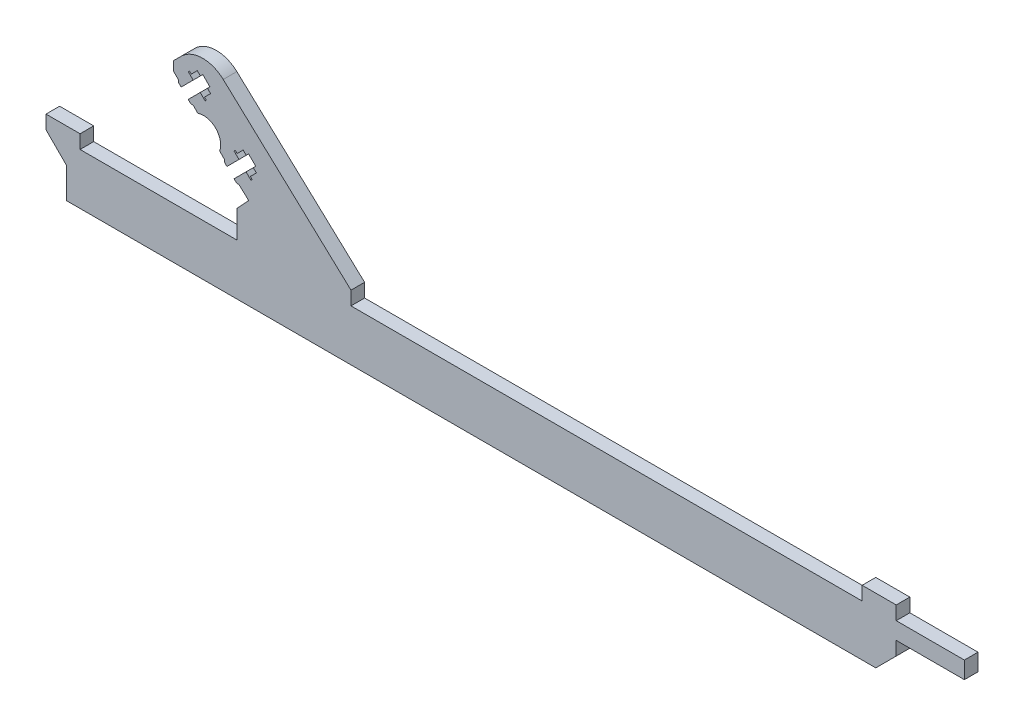
from build123d import *

# Parameters (mm, degrees)
BOSS_EXTRUDE1_DEPTH = 4
CHAMFER1_SIZE       = 6
SKETCH2_R           = 0.357314597
CUT_EXTRUDE1_DEPTH  = 1


with BuildPart() as part:
    # Sketch1 → Boss-Extrude1 (new body)
    with BuildSketch(Plane.XY):
        with BuildLine():
            Line((-193.5, 5), (-193.5, 13.029022597))
            Line((-193.5, 13.029022597), (-190.028351822, 16.768866664))
            Line((-190.028351822, 16.768866664), (-192.886698165, 19.422232071))
            Line((-192.886698165, 19.422232071), (-193.593804946, 19.422232071))
            Line((-193.593804946, 19.422232071), (-194.318589397, 20.147016522))
            Line((-194.318589397, 20.147016522), (-190.783055491, 23.682550428))
            Line((-190.783055491, 23.682550428), (-189.351164259, 22.250659196))
            Line((-189.351164259, 22.250659196), (-188.997610869, 22.604212587))
            Line((-188.997610869, 22.604212587), (-189.527940955, 23.134542672))
            Line((-189.527940955, 23.134542672), (-187.760174002, 24.902309625))
            Line((-187.760174002, 24.902309625), (-188.661735148, 25.803870771))
            Line((-188.661735148, 25.803870771), (-187.954628366, 26.510977553))
            Line((-187.954628366, 26.510977553), (-190.040593371, 28.596942557))
            Line((-190.040593371, 28.596942557), (-190.747700152, 27.889835776))
            Line((-190.747700152, 27.889835776), (-191.649261298, 28.791396922))
            Line((-191.649261298, 28.791396922), (-193.417028251, 27.023629969))
            Line((-193.417028251, 27.023629969), (-193.947358337, 27.553960055))
            Line((-193.947358337, 27.553960055), (-194.300911728, 27.200406664))
            Line((-194.300911728, 27.200406664), (-192.869020496, 25.768515432))
            Line((-192.869020496, 25.768515432), (-196.404532161, 22.233003767))
            Line((-196.404532161, 22.233003767), (-197.129316611, 22.957788218))
            Line((-197.129316611, 22.957788218), (-197.129316611, 23.664894999))
            Line((-197.129316611, 23.664894999), (-198.543530174, 25.079108562))
            ThreePointArc((-198.543530174, 25.079108562), (-199.69683639, 30.30316361), (-204.920891438, 31.456469826))
            Line((-204.920891438, 31.456469826), (-206.335105001, 32.870683389))
            Line((-206.335105001, 32.870683389), (-207.042211782, 32.870683389))
            Line((-207.042211782, 32.870683389), (-207.766996233, 33.595467839))
            Line((-207.766996233, 33.595467839), (-204.231484568, 37.130979504))
            Line((-204.231484568, 37.130979504), (-202.799593336, 35.699088272))
            Line((-202.799593336, 35.699088272), (-202.446039945, 36.052641663))
            Line((-202.446039945, 36.052641663), (-202.976370031, 36.582971749))
            Line((-202.976370031, 36.582971749), (-201.208603078, 38.350738702))
            Line((-201.208603078, 38.350738702), (-202.110164224, 39.252299848))
            Line((-202.110164224, 39.252299848), (-201.403057443, 39.959406629))
            Line((-201.403057443, 39.959406629), (-203.489022447, 42.045371634))
            Line((-203.489022447, 42.045371634), (-204.196129229, 41.338264852))
            Line((-204.196129229, 41.338264852), (-205.097690375, 42.239825998))
            Line((-205.097690375, 42.239825998), (-206.865457328, 40.472059045))
            Line((-206.865457328, 40.472059045), (-207.395787413, 41.002389131))
            Line((-207.395787413, 41.002389131), (-207.749340804, 40.648835741))
            Line((-207.749340804, 40.648835741), (-206.317449572, 39.216944509))
            Line((-206.317449572, 39.216944509), (-209.852983478, 35.681410603))
            Line((-209.852983478, 35.681410603), (-210.577767929, 36.406195054))
            Line((-210.577767929, 36.406195054), (-210.577767929, 37.113301835))
            Line((-210.577767929, 37.113301835), (-212.026855734, 38.56238964))
            Line((-212.026855734, 38.56238964), (-212.026855734, 41.337590552))
            Line((-212.026855734, 41.337590552), (-209.789156947, 43.57528934))
            ThreePointArc((-209.789156947, 43.57528934), (-203.686966217, 46.169596994), (-197.492575262, 43.803865688))
            Line((-197.492575262, 43.803865688), (-160, 9))
            Line((-160, 9), (-160, 5))
            Line((-160, 5), (-10, 5))
            Line((-10, 5), (-10, 9))
            Line((-10, 9), (0, 9))
            Line((0, 9), (0, 5))
            Line((0, 5), (20, 5))
            Line((20, 5), (20, 0))
            Line((20, 0), (0, 0))
            Line((0, 0), (0, -10))
            Line((0, -10), (-243.5, -10))
            Line((-243.5, -10), (-243.5, -1))
            Line((-243.5, -1), (-249.5, 5))
            Line((-249.5, 5), (-249.5, 9))
            Line((-249.5, 9), (-239.5, 9))
            Line((-239.5, 9), (-239.5, 5))
            Line((-239.5, 5), (-193.5, 5))
        make_face()
    extrude(amount=BOSS_EXTRUDE1_DEPTH)

    # Chamfer1
    chamfer1_edges = [part.edges().sort_by_distance(p)[0] for p in [
        (0, -10, 2),
    ]]
    chamfer(chamfer1_edges, length=CHAMFER1_SIZE)

    # Sketch2 → Cut-Extrude1 (cut)
    with BuildSketch(Plane(origin=(-80.721825407, -80.721825407, 0), x_dir=(0, 0, 1), z_dir=(-0.7071067811865454, -0.7071067811865497, 0))):
        with Locations(Location((2, 172.10347727, 0), (0, 0, 270))):
            Circle(SKETCH2_R)
        with Locations(Location((2, 153.121208308, 0), (0, 0, 270))):
            Circle(SKETCH2_R)
    extrude(amount=-CUT_EXTRUDE1_DEPTH, mode=Mode.SUBTRACT)


solid = part.part
